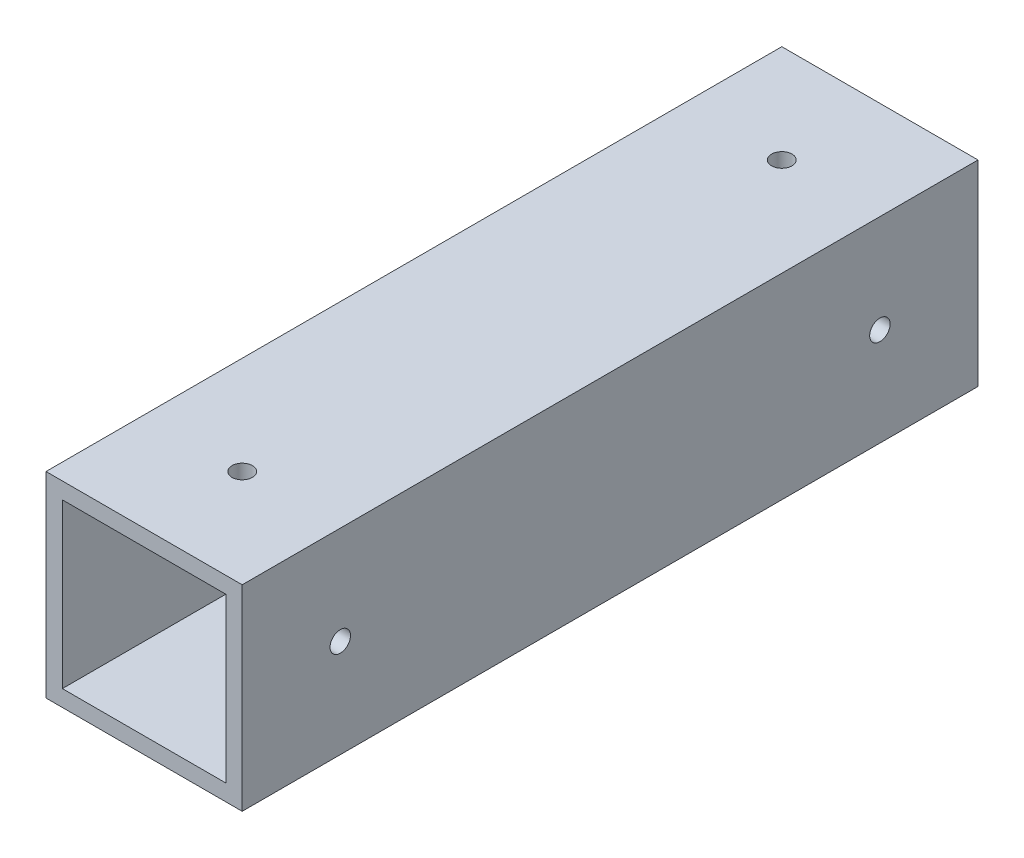
from build123d import *

# Parameters (mm, degrees)
SKETCH_1_W         = 24
SKETCH_1_H         = 24
SKETCH_1_W_2       = 20
SKETCH_1_H_2       = 20
EXTRUDE_1_DEPTH    = 45.005
HOLE_WIZARD_M3_1_D = 2.5
HOLE_WIZARD_M3_2_D = 2.5


with BuildPart() as part:
    # 草图1 → 凸台-拉伸1 (new, symmetric)
    with BuildSketch(Plane.XY):
        Rectangle(SKETCH_1_W, SKETCH_1_H)
        Rectangle(SKETCH_1_W_2, SKETCH_1_H_2, mode=Mode.SUBTRACT)
    extrude(amount=EXTRUDE_1_DEPTH, both=True)

    # M3 螺纹孔的螺纹孔钻头1 (through all)
    with Locations(Plane(origin=(-12, 0, -33.005), x_dir=(0, -1, 0), z_dir=(-1, 0, 0))):
        with Locations((0, 0)):
            hole_wizard_m3_1 = Hole(HOLE_WIZARD_M3_1_D / 2)

    # 镜向1: M3 螺纹孔的螺纹孔钻头1 across plane
    add(hole_wizard_m3_1.mirror(Plane.XY), mode=Mode.SUBTRACT)

    # M3 螺纹孔的螺纹孔钻头2 (through all)
    with Locations(Plane(origin=(0, 12, -33.005), x_dir=(0, 0, 1), z_dir=(0, 1, 0))):
        with Locations((0, 0)):
            hole_wizard_m3_2 = Hole(HOLE_WIZARD_M3_2_D / 2)

    # 镜向2: M3 螺纹孔的螺纹孔钻头2 across plane
    add(hole_wizard_m3_2.mirror(Plane.XY), mode=Mode.SUBTRACT)


solid = part.part
